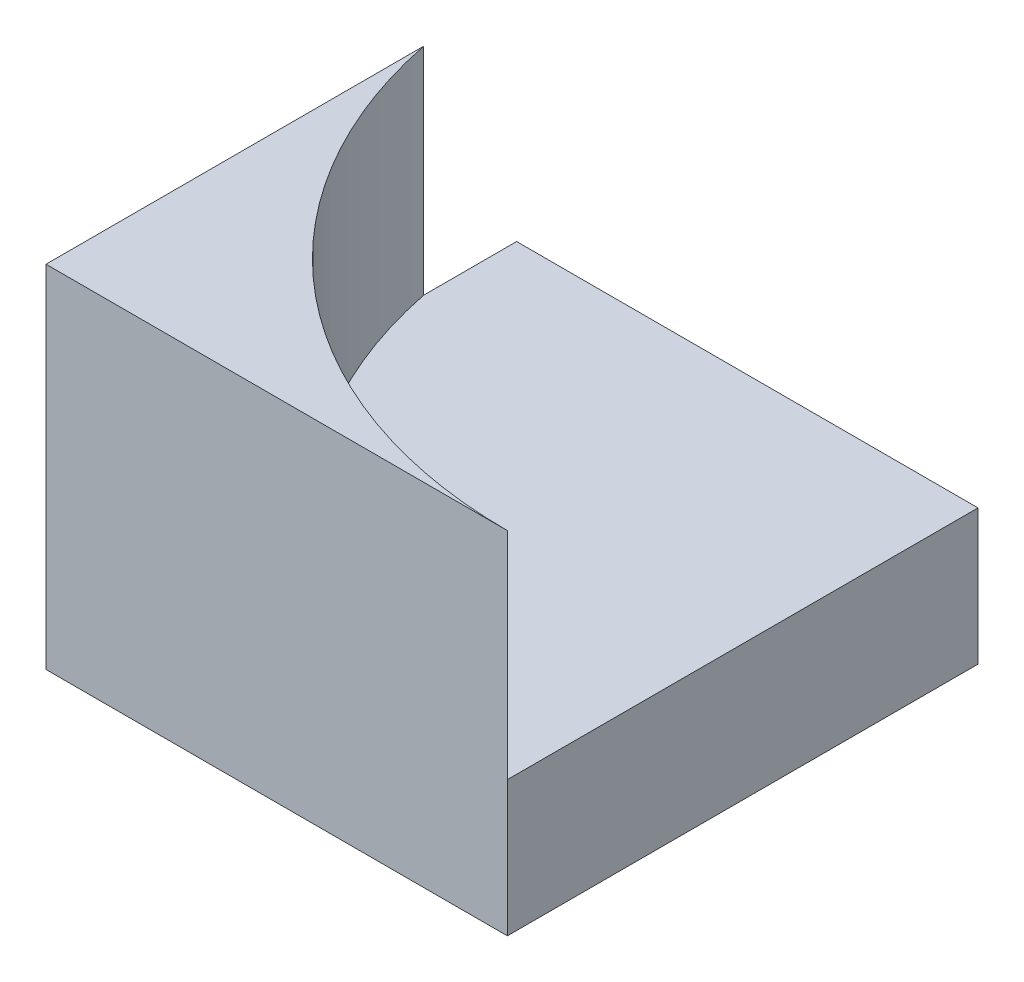
from build123d import *

# Parameters (mm, degrees)
SKETCH1_W           = 73.796067544
SKETCH1_H           = 98.946858939
BOSS_EXTRUDE1_DEPTH = 97
SKETCH2_W           = 45.344140944
SKETCH2_H           = 98.946858939


with BuildPart() as part:
    # Sketch1 → Boss-Extrude1 (new body)
    with BuildSketch(Plane.YZ):
        with Locations((-36.898033772, -49.47342947)):
            Rectangle(SKETCH1_W, SKETCH1_H)
    extrude(amount=BOSS_EXTRUDE1_DEPTH)

    # Sketch2 → Cut-Revolve1 (revolve, cut)
    with BuildSketch(Plane.YZ.offset(97)):
        with Locations((-22.672070472, -49.47342947)):
            Rectangle(SKETCH2_W, SKETCH2_H)
    revolve(axis=Axis((97, 0, -98.946858939), (0, -1, 0)), mode=Mode.SUBTRACT)


solid = part.part
